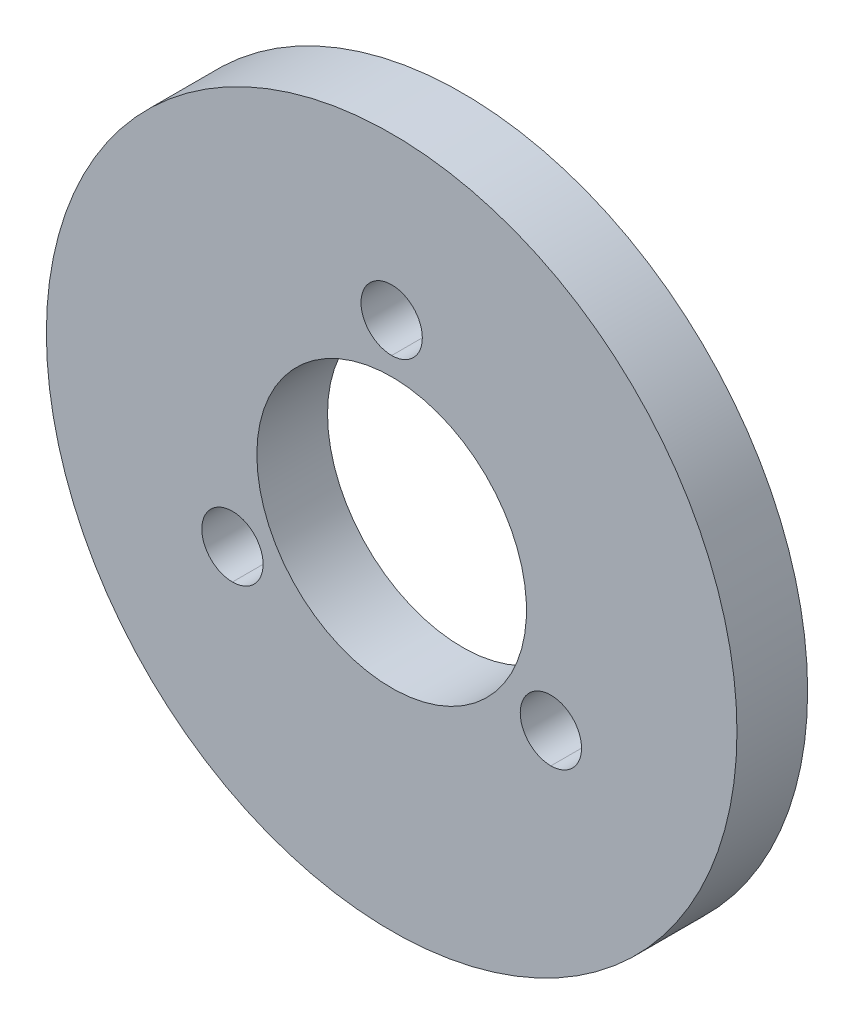
from build123d import *

# Parameters (mm, degrees)
SKETCH1_R           = 28.173882667
SKETCH1_R_2         = 2.5
SKETCH1_R_3         = 11
BOSS_EXTRUDE1_DEPTH = 5.7658


with BuildPart() as part:
    # Sketch1 → Boss-Extrude1 (new body)
    with BuildSketch(Plane.XY):
        Circle(SKETCH1_R)
        with Locations((0, 15)):
            Circle(SKETCH1_R_2, mode=Mode.SUBTRACT)
        with Locations((12.990381057, -7.5)):
            Circle(SKETCH1_R_2, mode=Mode.SUBTRACT)
        with Locations((-12.990381057, -7.5)):
            Circle(SKETCH1_R_2, mode=Mode.SUBTRACT)
        Circle(SKETCH1_R_3, mode=Mode.SUBTRACT)
    extrude(amount=BOSS_EXTRUDE1_DEPTH)


solid = part.part
